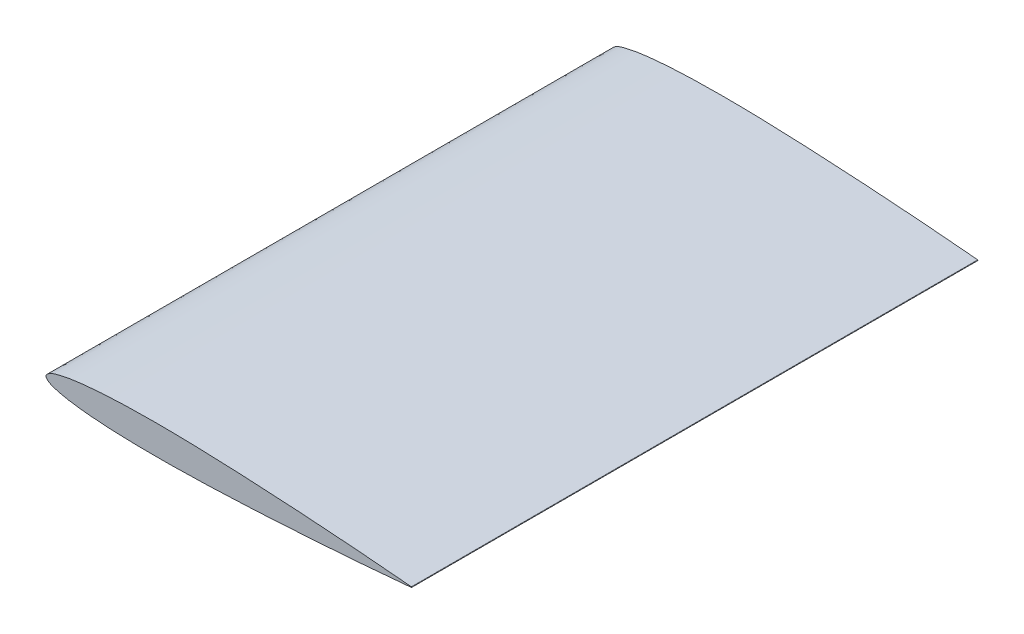
from build123d import *

# Parameters (mm, degrees)
CORPOFOAM_DEPTH         = 132
FOAMLATERALE_DEPTH      = 23
FOAMLATERALE_DEPTH_BACK = 132
SCHIZZO8_W              = 40
SCHIZZO8_H              = 4
TAGLIOSPINA_DEPTH       = 18


with BuildPart() as part:
    # Schizzo1 → CorpoFoam (new body)
    with BuildSketch(Plane.XY):
        with BuildLine():
            ThreePointArc((70, -2.443), (67.557, 0), (70, 2.443))
            add(Edge.make_bspline(
                [(70, 2.443), (66.667669045, 2.659279734), (60.003104625, 3.061747723), (50.003008601, 3.552139212), (40.002598558, 3.902946494), (31.666961486, 4.025260151), (24.9991546, 3.976933791), (19.997775587, 3.844976398), (14.993363131, 3.592486959), (10.827184065, 3.237651579), (7.489054388, 2.814021367), (4.99359465, 2.403673059), (2.84962634, 1.867925494), (1.165413503, 1.320987252), (-0.664613784, 0), (1.165413503, -1.320987252), (2.84962634, -1.867925494), (4.99359465, -2.403673059), (7.489054388, -2.814021367), (10.827184065, -3.237651579), (14.993363131, -3.592486959), (19.997775587, -3.844976398), (24.9991546, -3.976933791), (31.666961486, -4.025260151), (40.002598558, -3.902946494), (50.003008601, -3.552139212), (60.003104625, -3.061747723), (66.667669045, -2.659279734), (70, -2.443)],
                knots=[0.149112224, 0.149112224, 0.149112224, 0.149112224, 0.198750974, 0.248359097, 0.29793737, 0.347491327, 0.37226694, 0.397050924, 0.421859475, 0.446731346, 0.459220451, 0.471790602, 0.484560454, 0.491195112, 0.5, 0.508804888, 0.515439546, 0.528209398, 0.540779549, 0.553268654, 0.578140525, 0.602949076, 0.62773306, 0.652508673, 0.70206263, 0.751640903, 0.801249026, 0.850887776, 0.850887776, 0.850887776, 0.850887776], degree=3))
        make_face()
    extrude(amount=CORPOFOAM_DEPTH)

    # Schizzo7 → FoamLaterale (add, two sides: drawn at the far end of the back side and taken through both)
    with BuildSketch(Plane.XY.offset(132).offset(-FOAMLATERALE_DEPTH_BACK)):
        with BuildLine():
            ThreePointArc((100, 0.084), (100.084, 0), (100, -0.084))
            add(Edge.make_bspline(
                [(100, 0.084), (98.333488815, 0.23674648), (95.001194725, 0.542172689), (88.335559621, 1.11089898), (80.003293356, 1.763610995), (70.002998933, 2.457861693), (60.003104625, 3.061747723), (50.003008601, 3.552139212), (40.002598558, 3.902946494), (31.666961486, 4.025260151), (24.9991546, 3.976933791), (19.997775587, 3.844976398), (14.993363131, 3.592486959), (10.827184065, 3.237651579), (7.489054388, 2.814021367), (4.99359465, 2.403673059), (2.84962634, 1.867925494), (1.165413503, 1.320987252), (-0.664613784, 0), (1.165413503, -1.320987252), (2.84962634, -1.867925494), (4.99359465, -2.403673059), (7.489054388, -2.814021367), (10.827184065, -3.237651579), (14.993363131, -3.592486959), (19.997775587, -3.844976398), (24.9991546, -3.976933791), (31.666961486, -4.025260151), (40.002598558, -3.902946494), (50.003008601, -3.552139212), (60.003104625, -3.061747723), (70.002998933, -2.457861693), (80.003293356, -1.763610995), (88.335559621, -1.11089898), (95.001194725, -0.542172689), (98.333488815, -0.23674648), (100, -0.084)],
                knots=[0, 0, 0, 0, 0.024876293, 0.049741715, 0.099443402, 0.149112224, 0.198750974, 0.248359097, 0.29793737, 0.347491327, 0.37226694, 0.397050924, 0.421859475, 0.446731346, 0.459220451, 0.471790602, 0.484560454, 0.491195112, 0.5, 0.508804888, 0.515439546, 0.528209398, 0.540779549, 0.553268654, 0.578140525, 0.602949076, 0.62773306, 0.652508673, 0.70206263, 0.751640903, 0.801249026, 0.850887776, 0.900556598, 0.950258285, 0.975123707, 1, 1, 1, 1], degree=3))
        make_face()
    extrude(amount=FOAMLATERALE_DEPTH + FOAMLATERALE_DEPTH_BACK)

    # Schizzo8 → TaglioSpina (cut)
    with BuildSketch(Plane(origin=(0, 0, 0), x_dir=(-1, 0, 0), z_dir=(0, 0, -1))):
        with Locations((-35, 0)):
            Rectangle(SCHIZZO8_W, SCHIZZO8_H)
    extrude(amount=-TAGLIOSPINA_DEPTH, mode=Mode.SUBTRACT)


solid = part.part
